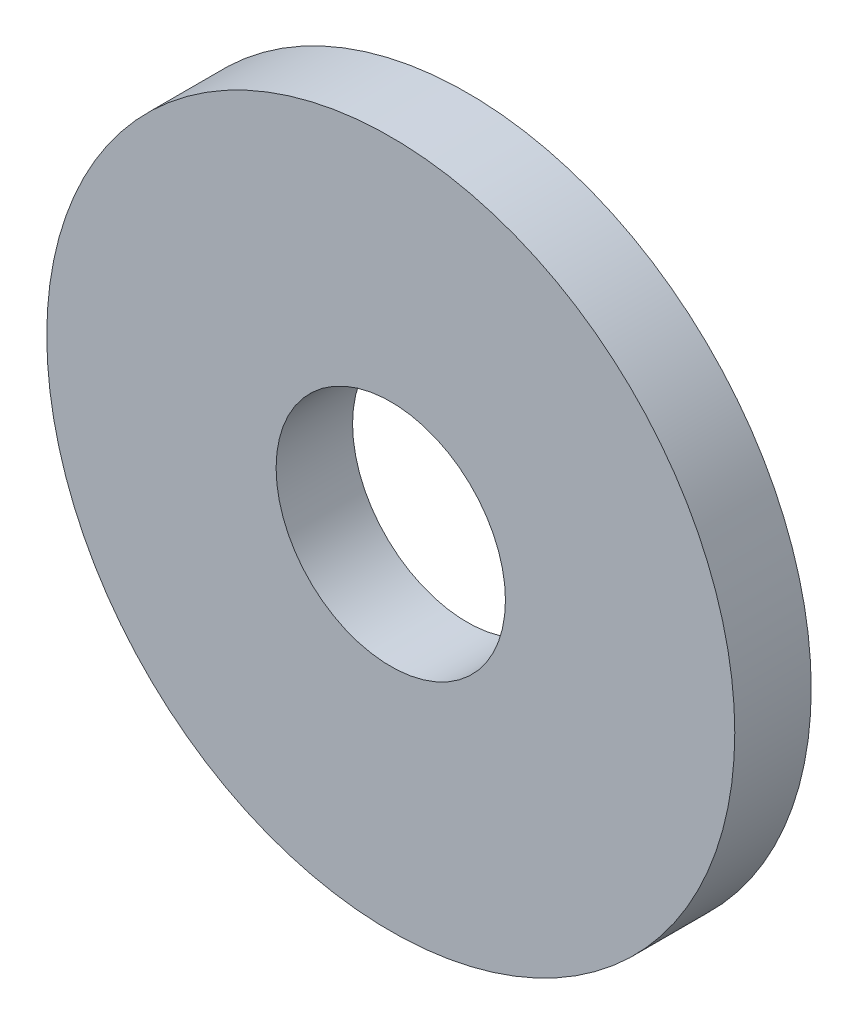
from build123d import *

# Parameters (mm, degrees)
SKETCH_1_R      = 4.5
SKETCH_1_R_2    = 1.5
EXTRUDE_1_DEPTH = 0.5


with BuildPart() as part:
    # 草图1 → 凸台-拉伸1 (new, symmetric)
    with BuildSketch(Plane.XY):
        Circle(SKETCH_1_R)
        Circle(SKETCH_1_R_2, mode=Mode.SUBTRACT)
    extrude(amount=EXTRUDE_1_DEPTH, both=True)


solid = part.part
